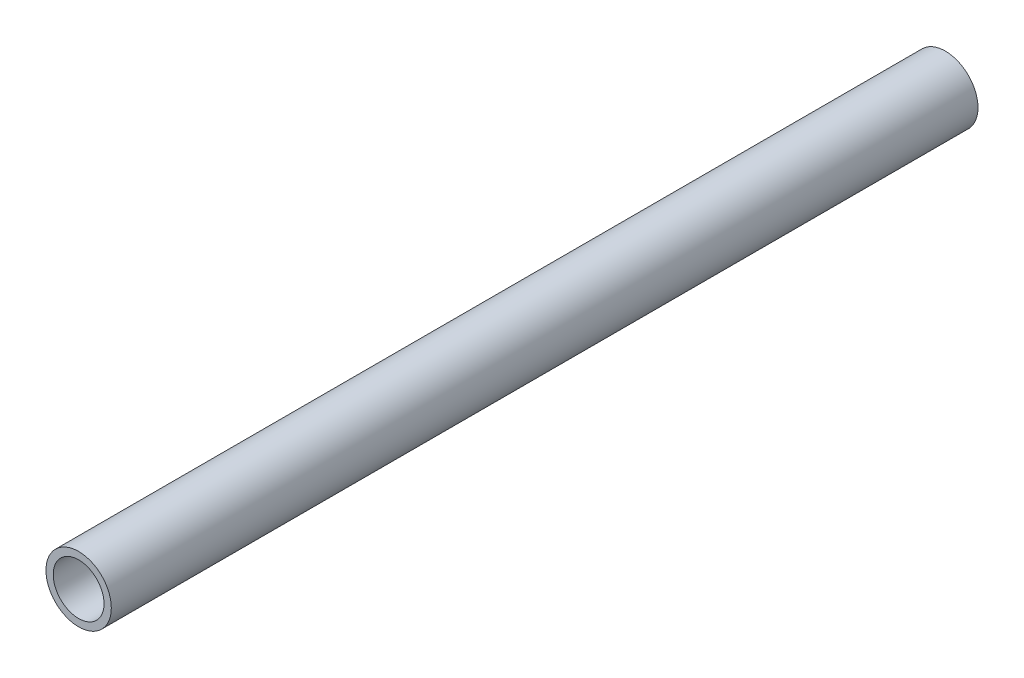
from build123d import *

# Parameters (mm, degrees)
SKETCH1_R           = 9
SKETCH1_R_2         = 7
BOSS_EXTRUDE1_DEPTH = 238.63


with BuildPart() as part:
    # Sketch1 → Boss-Extrude1 (new body)
    with BuildSketch(Plane.XY):
        Circle(SKETCH1_R)
        Circle(SKETCH1_R_2, mode=Mode.SUBTRACT)
    extrude(amount=BOSS_EXTRUDE1_DEPTH)


solid = part.part
